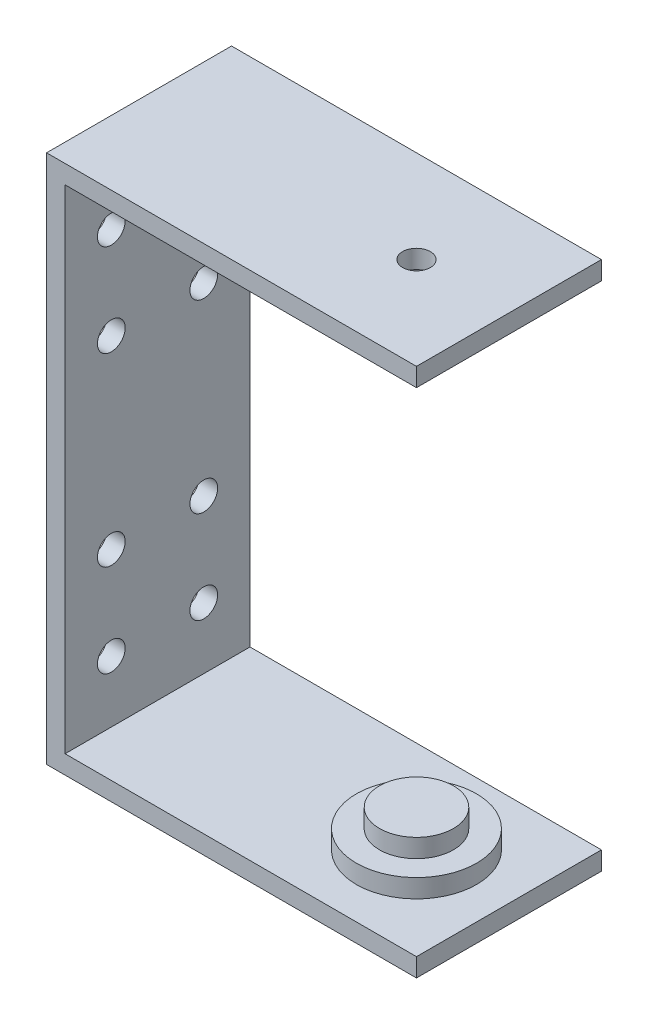
from build123d import *

# Parameters (mm, degrees)
SKETCH1_R                 = 6.5
SKETCH1_R_2               = 4
SKETCH1_R_3               = 2.8
SKETCH1_R_4               = 1.5
BOSS_EXTRUDE1_DEPTH       = 2
BOSS_EXTRUDE2_START       = 2
SKETCH1_3_R               = 4
SKETCH1_3_R_2             = 2.8
SKETCH1_3_R_3             = 1.5
BOSS_EXTRUDE2_DEPTH       = 2
SKETCH1_4_W               = 40
SKETCH1_4_H               = 20
BOSS_EXTRUDE3_DEPTH       = 2
SKETCH2_W                 = 2
SKETCH2_H                 = 20
BOSS_EXTRUDE4_DEPTH       = 53.28
BOSS_EXTRUDE5_START       = 53.28
SKETCH1_5_W               = 40
SKETCH1_5_H               = 20
SKETCH1_5_R               = 6.5
SKETCH1_5_R_2             = 4
SKETCH1_5_R_3             = 2.8
SKETCH1_5_R_4             = 1.5
BOSS_EXTRUDE5_DEPTH       = 2
BOSS_EXTRUDE6_START       = 51.28
SKETCH1_6_R               = 4
SKETCH1_6_R_2             = 2.8
BOSS_EXTRUDE6_DEPTH       = 2
F_3_0MM_DOWEL_HOLE1_D     = 3
F_3_0MM_DOWEL_HOLE1_DEPTH = 7
F_3_0MM_DOWEL_HOLE1_TIP   = 0.901290929


with BuildPart() as part:
    # Sketch1 → Boss-Extrude1 (new body)
    # profile 1 of 4: a face of its own
    with BuildSketch(Plane(origin=(0, 0, 0), x_dir=(1, 0, 0), z_dir=(0, 1, 0))):
        with Locations(Location((0, 0, 0), (0, 0, 270))):
            Circle(SKETCH1_R)
        Circle(SKETCH1_R_2, mode=Mode.SUBTRACT)
    # profile 2 of 4: a face of its own
    with BuildSketch(Plane(origin=(0, 0, 0), x_dir=(1, 0, 0), z_dir=(0, 1, 0))):
        Circle(SKETCH1_R_2)
        Circle(SKETCH1_R_3, mode=Mode.SUBTRACT)
    # profile 3 of 4: a face of its own
    with BuildSketch(Plane(origin=(0, 0, 0), x_dir=(1, 0, 0), z_dir=(0, 1, 0))):
        Circle(SKETCH1_R_3)
        Circle(SKETCH1_R_4, mode=Mode.SUBTRACT)
    # profile 4 of 4: a face of its own
    with BuildSketch(Plane(origin=(0, 0, 0), x_dir=(1, 0, 0), z_dir=(0, 1, 0))):
        Circle(SKETCH1_R_4)
    extrude(amount=BOSS_EXTRUDE1_DEPTH)

    # Sketch1<3> → Boss-Extrude2 (add)
    # profile 1 of 3: a face of its own
    with BuildSketch(Plane(origin=(0, 0, 0), x_dir=(1, 0, 0), z_dir=(0, 1, 0)).offset(BOSS_EXTRUDE2_START)):
        with Locations(Location((0, 0, 0), (0, 0, 270))):
            Circle(SKETCH1_3_R)
        Circle(SKETCH1_3_R_2, mode=Mode.SUBTRACT)
    # profile 2 of 3: a face of its own
    with BuildSketch(Plane(origin=(0, 0, 0), x_dir=(1, 0, 0), z_dir=(0, 1, 0)).offset(BOSS_EXTRUDE2_START)):
        Circle(SKETCH1_3_R_2)
        Circle(SKETCH1_3_R_3, mode=Mode.SUBTRACT)
    # profile 3 of 3: a face of its own
    with BuildSketch(Plane(origin=(0, 0, 0), x_dir=(1, 0, 0), z_dir=(0, 1, 0)).offset(BOSS_EXTRUDE2_START)):
        Circle(SKETCH1_3_R_3)
    extrude(amount=BOSS_EXTRUDE2_DEPTH)

    # Sketch1<4> → Boss-Extrude3 (add)
    with BuildSketch(Plane(origin=(0, 0, 0), x_dir=(1, 0, 0), z_dir=(0, 1, 0))):
        with Locations((-10, 0)):
            Rectangle(SKETCH1_4_W, SKETCH1_4_H)
    extrude(amount=-BOSS_EXTRUDE3_DEPTH)

    # Sketch2 → Boss-Extrude4 (add)
    with BuildSketch(Plane(origin=(0, 0, 0), x_dir=(1, 0, 0), z_dir=(0, 1, 0))):
        with Locations((-29, 0)):
            Rectangle(SKETCH2_W, SKETCH2_H)
    extrude(amount=BOSS_EXTRUDE4_DEPTH)

    # Sketch1<5> → Boss-Extrude5 (add)
    # profile 1 of 4: a face of its own
    with BuildSketch(Plane(origin=(0, 0, 0), x_dir=(1, 0, 0), z_dir=(0, 1, 0)).offset(BOSS_EXTRUDE5_START)):
        with Locations((-10, 0)):
            Rectangle(SKETCH1_5_W, SKETCH1_5_H)
        with Locations(Location((0, 0, 0), (0, 0, 270))):
            Circle(SKETCH1_5_R, mode=Mode.SUBTRACT)
    # profile 2 of 4: a face of its own
    with BuildSketch(Plane(origin=(0, 0, 0), x_dir=(1, 0, 0), z_dir=(0, 1, 0)).offset(BOSS_EXTRUDE5_START)):
        with Locations(Location((0, 0, 0), (0, 0, 270))):
            Circle(SKETCH1_5_R)
        with Locations(Location((0, 0, 0), (0, 0, 270))):
            Circle(SKETCH1_5_R_2, mode=Mode.SUBTRACT)
    # profile 3 of 4: a face of its own
    with BuildSketch(Plane(origin=(0, 0, 0), x_dir=(1, 0, 0), z_dir=(0, 1, 0)).offset(BOSS_EXTRUDE5_START)):
        with Locations(Location((0, 0, 0), (0, 0, 270))):
            Circle(SKETCH1_5_R_2)
        Circle(SKETCH1_5_R_3, mode=Mode.SUBTRACT)
    # profile 4 of 4: a face of its own
    with BuildSketch(Plane(origin=(0, 0, 0), x_dir=(1, 0, 0), z_dir=(0, 1, 0)).offset(BOSS_EXTRUDE5_START)):
        Circle(SKETCH1_5_R_3)
        with Locations(Location((0, 0, 0), (0, 0, 270))):
            Circle(SKETCH1_5_R_4, mode=Mode.SUBTRACT)
    extrude(amount=BOSS_EXTRUDE5_DEPTH)

    # Sketch1<6> → Boss-Extrude6 (add)
    with BuildSketch(Plane(origin=(0, 0, 0), x_dir=(1, 0, 0), z_dir=(0, 1, 0)).offset(BOSS_EXTRUDE6_START)):
        with Locations(Location((0, 0, 0), (0, 0, 270))):
            Circle(SKETCH1_6_R)
        with Locations(Location((0, 0, 0), (0, 0, 90))):
            Circle(SKETCH1_6_R_2, mode=Mode.SUBTRACT)
    extrude(amount=BOSS_EXTRUDE6_DEPTH)

    # Ø3.0mm Dowel Hole1
    with Locations(Plane.ZY.offset(30)):
        with Locations((-5, 46.64), (5, 46.64), (-5, 36.64), (5, 36.64), (-5, 16.64), (5, 16.64), (-5, 6.64), (5, 6.64)):
            Hole(F_3_0MM_DOWEL_HOLE1_D / 2, depth=F_3_0MM_DOWEL_HOLE1_DEPTH)
            with Locations((0, 0, -(F_3_0MM_DOWEL_HOLE1_DEPTH + F_3_0MM_DOWEL_HOLE1_TIP / 2))):  # 118° drill point
                Cone(0, F_3_0MM_DOWEL_HOLE1_D / 2, F_3_0MM_DOWEL_HOLE1_TIP, mode=Mode.SUBTRACT)


solid = part.part
